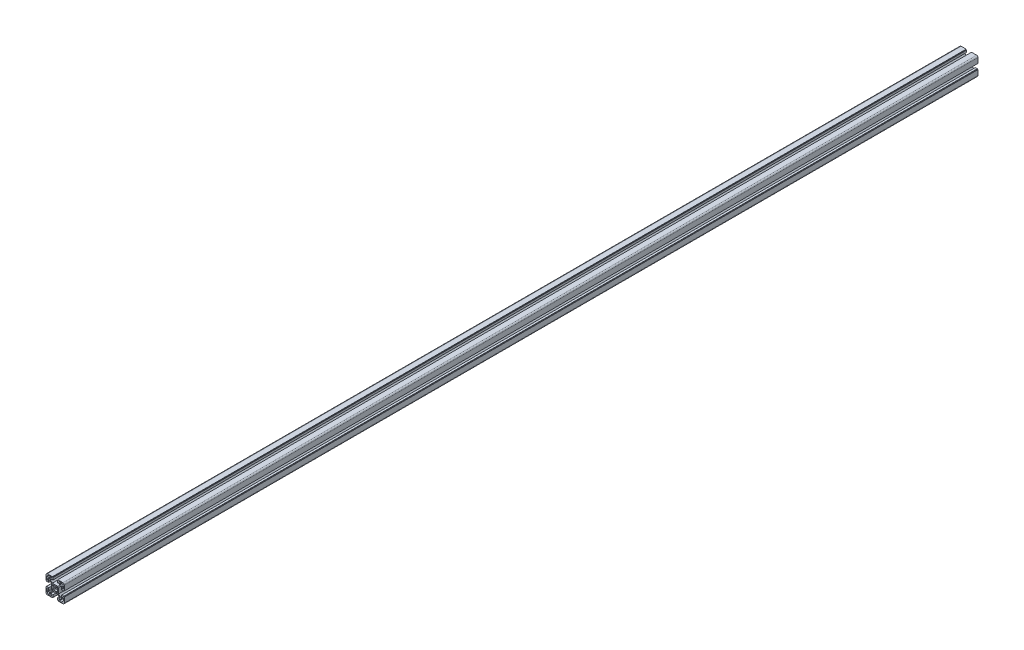
from build123d import *

# Parameters (mm, degrees)
EXTRUDE1_DEPTH = 2000


with BuildPart() as part:
    # Sketch1 → Extrude1 (new body)
    with BuildSketch(Plane.XY):
        with BuildLine():
            Line((5.8, -20), (17, -20))
            ThreePointArc((17, -20), (19.121320344, -19.121320344), (20, -17))
            Line((20, -17), (20, -5.8))
            Line((20, -5.8), (18.5, -5.8))
            Line((18.5, -5.8), (18.5, -5))
            Line((18.5, -5), (14, -5))
            Line((14, -5), (14, -10.05))
            Line((14, -10.05), (11.464213562, -10.05))
            Line((11.464213562, -10.05), (7.5, -6.085786438))
            Line((7.5, -6.085786438), (7.5, 6.085786438))
            Line((7.5, 6.085786438), (11.464213562, 10.05))
            Line((11.464213562, 10.05), (14, 10.05))
            Line((14, 10.05), (14, 5))
            Line((14, 5), (18.5, 5))
            Line((18.5, 5), (18.5, 5.8))
            Line((18.5, 5.8), (20, 5.8))
            Line((20, 5.8), (20, 17))
            ThreePointArc((20, 17), (19.121320344, 19.121320344), (17, 20))
            Line((17, 20), (5.8, 20))
            Line((5.8, 20), (5.8, 18.5))
            Line((5.8, 18.5), (5, 18.5))
            Line((5, 18.5), (5, 14))
            Line((5, 14), (10.05, 14))
            Line((10.05, 14), (10.05, 11.464213562))
            Line((10.05, 11.464213562), (6.085786438, 7.5))
            Line((6.085786438, 7.5), (-6.085786438, 7.5))
            Line((-6.085786438, 7.5), (-10.05, 11.464213562))
            Line((-10.05, 11.464213562), (-10.05, 14))
            Line((-10.05, 14), (-5, 14))
            Line((-5, 14), (-5, 18.5))
            Line((-5, 18.5), (-5.8, 18.5))
            Line((-5.8, 18.5), (-5.8, 20))
            Line((-5.8, 20), (-17, 20))
            ThreePointArc((-17, 20), (-19.121320344, 19.121320344), (-20, 17))
            Line((-20, 17), (-20, 5.8))
            Line((-20, 5.8), (-18.5, 5.8))
            Line((-18.5, 5.8), (-18.5, 5))
            Line((-18.5, 5), (-14, 5))
            Line((-14, 5), (-14, 10.05))
            Line((-14, 10.05), (-11.464213562, 10.05))
            Line((-11.464213562, 10.05), (-7.5, 6.085786438))
            Line((-7.5, 6.085786438), (-7.5, -6.085786438))
            Line((-7.5, -6.085786438), (-11.464213562, -10.05))
            Line((-11.464213562, -10.05), (-14, -10.05))
            Line((-14, -10.05), (-14, -5))
            Line((-14, -5), (-18.5, -5))
            Line((-18.5, -5), (-18.5, -5.8))
            Line((-18.5, -5.8), (-20, -5.8))
            Line((-20, -5.8), (-20, -17))
            ThreePointArc((-20, -17), (-19.121320344, -19.121320344), (-17, -20))
            Line((-17, -20), (-5.8, -20))
            Line((-5.8, -20), (-5.8, -18.5))
            Line((-5.8, -18.5), (-5, -18.5))
            Line((-5, -18.5), (-5, -14))
            Line((-5, -14), (-10.05, -14))
            Line((-10.05, -14), (-10.05, -11.464213562))
            Line((-10.05, -11.464213562), (-6.085786438, -7.5))
            Line((-6.085786438, -7.5), (6.085786438, -7.5))
            Line((6.085786438, -7.5), (10.05, -11.464213562))
            Line((10.05, -11.464213562), (10.05, -14))
            Line((10.05, -14), (5, -14))
            Line((5, -14), (5, -18.5))
            Line((5, -18.5), (5.8, -18.5))
            Line((5.8, -18.5), (5.8, -20))
        make_face()
        with BuildLine():
            Line((14.5, -18.5), (9.5, -18.5))
            ThreePointArc((9.5, -18.5), (8, -17), (9.5, -15.5))
            Line((9.5, -15.5), (11.75, -15.5))
            Line((11.75, -15.5), (11.75, -14.5))
            ThreePointArc((11.75, -14.5), (12.555456352, -12.555456352), (14.5, -11.75))
            Line((14.5, -11.75), (15.5, -11.75))
            Line((15.5, -11.75), (15.5, -9.5))
            ThreePointArc((15.5, -9.5), (17, -8), (18.5, -9.5))
            Line((18.5, -9.5), (18.5, -14.5))
            Line((18.5, -14.5), (17.25, -14.5))
            ThreePointArc((17.25, -14.5), (16.444543648, -16.444543648), (14.5, -17.25))
            Line((14.5, -17.25), (14.5, -18.5))
        make_face(mode=Mode.SUBTRACT)
        with BuildLine():
            Line((18.5, 14.5), (17.25, 14.5))
            ThreePointArc((17.25, 14.5), (16.444543648, 16.444543648), (14.5, 17.25))
            Line((14.5, 17.25), (14.5, 18.5))
            Line((14.5, 18.5), (9.5, 18.5))
            ThreePointArc((9.5, 18.5), (8, 17), (9.5, 15.5))
            Line((9.5, 15.5), (11.75, 15.5))
            Line((11.75, 15.5), (11.75, 14.5))
            ThreePointArc((11.75, 14.5), (12.555456352, 12.555456352), (14.5, 11.75))
            Line((14.5, 11.75), (15.5, 11.75))
            Line((15.5, 11.75), (15.5, 9.5))
            ThreePointArc((15.5, 9.5), (17, 8), (18.5, 9.5))
            Line((18.5, 9.5), (18.5, 14.5))
        make_face(mode=Mode.SUBTRACT)
        with BuildLine():
            Line((5.5, 5.5), (2.397915762, 5.5))
            Line((2.397915762, 5.5), (1.998263135, 4.583333333))
            ThreePointArc((1.998263135, 4.583333333), (0, 5), (-1.998263135, 4.583333333))
            Line((-1.998263135, 4.583333333), (-2.397915762, 5.5))
            Line((-2.397915762, 5.5), (-5.5, 5.5))
            Line((-5.5, 5.5), (-5.5, 2.397915762))
            Line((-5.5, 2.397915762), (-4.583333333, 1.998263135))
            ThreePointArc((-4.583333333, 1.998263135), (-5, 0), (-4.583333333, -1.998263135))
            Line((-4.583333333, -1.998263135), (-5.5, -2.397915762))
            Line((-5.5, -2.397915762), (-5.5, -5.5))
            Line((-5.5, -5.5), (-2.397915762, -5.5))
            Line((-2.397915762, -5.5), (-1.998263135, -4.583333333))
            ThreePointArc((-1.998263135, -4.583333333), (0, -5), (1.998263135, -4.583333333))
            Line((1.998263135, -4.583333333), (2.397915762, -5.5))
            Line((2.397915762, -5.5), (5.5, -5.5))
            Line((5.5, -5.5), (5.5, -2.397915762))
            Line((5.5, -2.397915762), (4.583333333, -1.998263135))
            ThreePointArc((4.583333333, -1.998263135), (5, 0), (4.583333333, 1.998263135))
            Line((4.583333333, 1.998263135), (5.5, 2.397915762))
            Line((5.5, 2.397915762), (5.5, 5.5))
        make_face(mode=Mode.SUBTRACT)
        with BuildLine():
            Line((-18.5, -14.5), (-17.25, -14.5))
            ThreePointArc((-17.25, -14.5), (-16.444543648, -16.444543648), (-14.5, -17.25))
            Line((-14.5, -17.25), (-14.5, -18.5))
            Line((-14.5, -18.5), (-9.5, -18.5))
            ThreePointArc((-9.5, -18.5), (-8, -17), (-9.5, -15.5))
            Line((-9.5, -15.5), (-11.75, -15.5))
            Line((-11.75, -15.5), (-11.75, -14.5))
            ThreePointArc((-11.75, -14.5), (-12.555456352, -12.555456352), (-14.5, -11.75))
            Line((-14.5, -11.75), (-15.5, -11.75))
            Line((-15.5, -11.75), (-15.5, -9.5))
            ThreePointArc((-15.5, -9.5), (-17, -8), (-18.5, -9.5))
            Line((-18.5, -9.5), (-18.5, -14.5))
        make_face(mode=Mode.SUBTRACT)
        with BuildLine():
            Line((-14.5, 18.5), (-9.5, 18.5))
            ThreePointArc((-9.5, 18.5), (-8, 17), (-9.5, 15.5))
            Line((-9.5, 15.5), (-11.75, 15.5))
            Line((-11.75, 15.5), (-11.75, 14.5))
            ThreePointArc((-11.75, 14.5), (-12.555456352, 12.555456352), (-14.5, 11.75))
            Line((-14.5, 11.75), (-15.5, 11.75))
            Line((-15.5, 11.75), (-15.5, 9.5))
            ThreePointArc((-15.5, 9.5), (-17, 8), (-18.5, 9.5))
            Line((-18.5, 9.5), (-18.5, 14.5))
            Line((-18.5, 14.5), (-17.25, 14.5))
            ThreePointArc((-17.25, 14.5), (-16.444543648, 16.444543648), (-14.5, 17.25))
            Line((-14.5, 17.25), (-14.5, 18.5))
        make_face(mode=Mode.SUBTRACT)
    extrude(amount=EXTRUDE1_DEPTH)


solid = part.part
